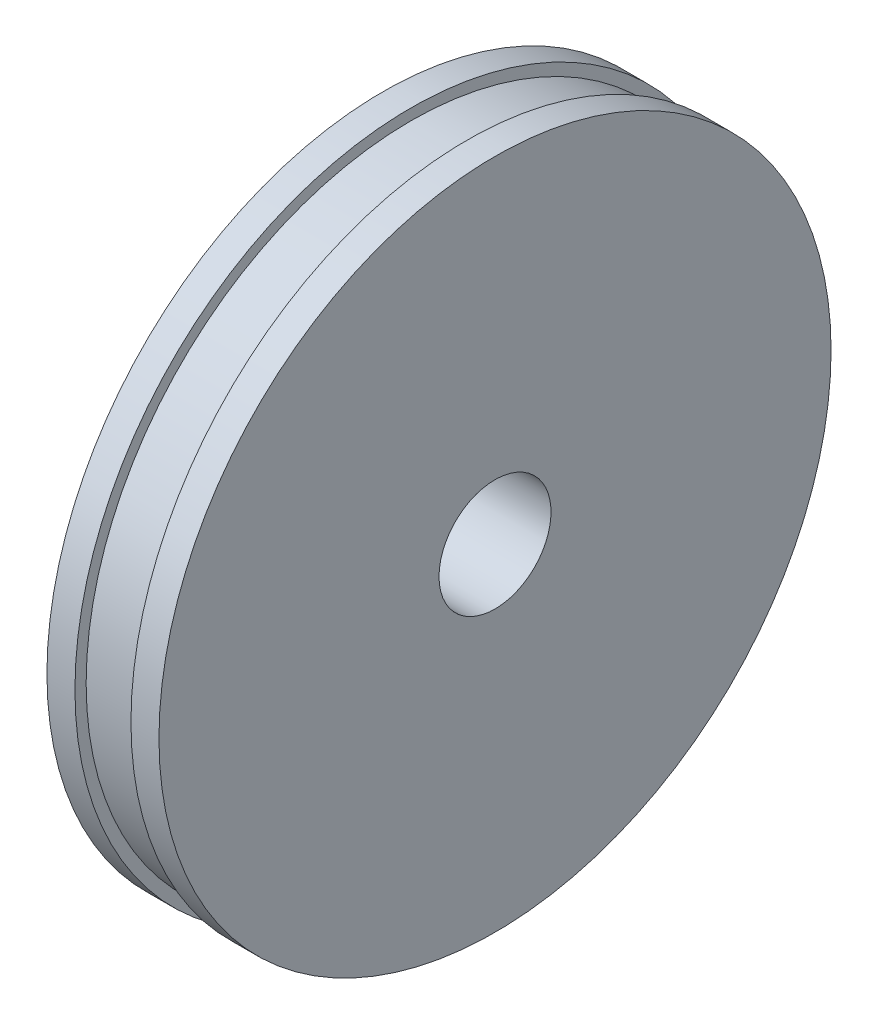
from build123d import *

# Parameters (mm, degrees)
SKETCH2_R          = 50
CUT_EXTRUDE1_DEPTH = 436.889894354


with BuildPart() as part:
    # Sketch1 → Revolve1 (revolve)
    with BuildSketch(Plane.XY, mode=Mode.PRIVATE) as revolve1_sk:
        Polygon((0, 0), (0, 300), (25, 300), (25, 290), (75, 290), (75, 300), (100, 300), (100, 0), align=None)
    revolve(revolve1_sk.sketch.rotate(Axis((0, 0, 0), (1, 0, 0)), 90), axis=Axis((0, 0, 0), (1, 0, 0)))

    # Sketch2 → Cut-Extrude1 (cut, through all)
    with BuildSketch(Plane.ZY):
        Circle(SKETCH2_R)
    extrude(amount=-CUT_EXTRUDE1_DEPTH, mode=Mode.SUBTRACT)


solid = part.part
